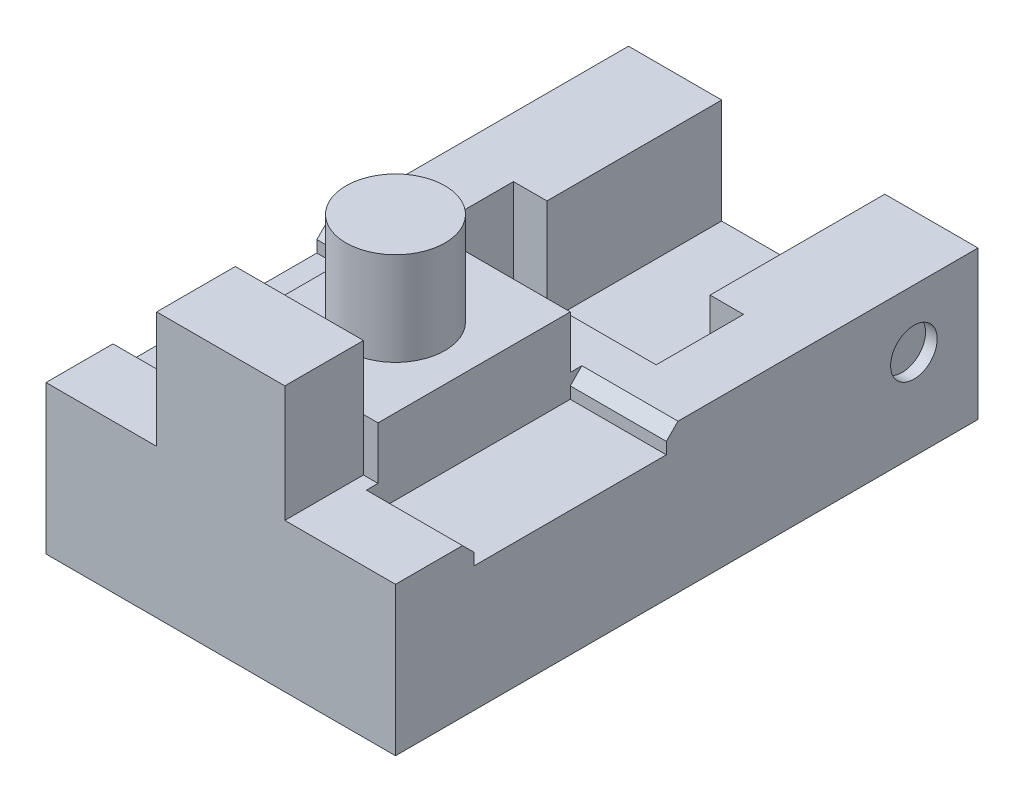
from build123d import *

# Parameters (mm, degrees)
BOSS_EXTRUDE1_DEPTH = 1.8
SKETCH2_W           = 6
SKETCH2_H           = 10
BOSS_EXTRUDE2_DEPTH = 0.75
SKETCH3_W           = 2.7
SKETCH3_H           = 3.3
BOSS_EXTRUDE3_DEPTH = 0.9
SKETCH4_R           = 0.85
BOSS_EXTRUDE4_DEPTH = 1.6
SKETCH5_W           = 2.2
SKETCH5_H           = 1.35
BOSS_EXTRUDE5_DEPTH = 2
SKETCH7_W           = 1.65
SKETCH7_H           = 3.3
CUT_EXTRUDE2_DEPTH  = 0.4
CHAMFER1_SIZE       = 0.2
SKETCH9_R           = 0.4
CUT_EXTRUDE4_DEPTH  = 0.2


with BuildPart() as part:
    # Sketch1 → Boss-Extrude1 (new body)
    with BuildSketch(Plane(origin=(0, 0, 0), x_dir=(1, 0, 0), z_dir=(0, 1, 0))):
        Polygon((-1.4, 3), (-1.4, 0), (-1.975, 0), (-1.975, -1.5), (1.975, -1.5), (1.975, 0), (1.4, 0), (1.4, 3), (3, 3), (3, -7), (-3, -7), (-3, 3), align=None)
    extrude(amount=BOSS_EXTRUDE1_DEPTH)

    # Sketch2 → Boss-Extrude2 (add)
    with BuildSketch(Plane.XZ):
        with Locations((0, 2)):
            Rectangle(SKETCH2_W, SKETCH2_H)
    extrude(amount=BOSS_EXTRUDE2_DEPTH)

    # Sketch3 → Boss-Extrude3 (add)
    with BuildSketch(Plane(origin=(0, 1.8, 0), x_dir=(1, 0, 0), z_dir=(0, 1, 0))):
        with Locations((0, -4)):
            Rectangle(SKETCH3_W, SKETCH3_H)
    extrude(amount=BOSS_EXTRUDE3_DEPTH)

    # Sketch4 → Boss-Extrude4 (add)
    with BuildSketch(Plane(origin=(0, 2.7, 0), x_dir=(1, 0, 0), z_dir=(0, 1, 0))):
        with Locations(Location((0, -4, 0), (0, 0, 270))):
            Circle(SKETCH4_R)
    extrude(amount=BOSS_EXTRUDE4_DEPTH)

    # Sketch5 → Boss-Extrude5 (add)
    with BuildSketch(Plane(origin=(0, 1.8, 0), x_dir=(1, 0, 0), z_dir=(0, 1, 0))):
        with Locations((0, -6.325)):
            Rectangle(SKETCH5_W, SKETCH5_H)
    extrude(amount=BOSS_EXTRUDE5_DEPTH)

    # Sketch7 → Cut-Extrude2 (cut)
    with BuildSketch(Plane(origin=(0, 1.8, 0), x_dir=(1, 0, 0), z_dir=(0, 1, 0))):
        with Locations((-2.175, -4)):
            Rectangle(SKETCH7_W, SKETCH7_H)
        with Locations((2.175, -4)):
            Rectangle(SKETCH7_W, SKETCH7_H)
    extrude(amount=-CUT_EXTRUDE2_DEPTH, mode=Mode.SUBTRACT)

    # Chamfer1
    chamfer1_edges = [part.edges().sort_by_distance(p)[0] for p in [
        (-2.175, 1.8, 2.35),
        (-2.175, 1.8, 5.65),
        (2.175, 1.8, 5.65),
        (2.175, 1.8, 2.35),
    ]]
    chamfer(chamfer1_edges, length=CHAMFER1_SIZE)

    # Sketch9 → Cut-Extrude4 (cut)
    with BuildSketch(Plane(origin=(3, 0, 0), x_dir=(0, 0, -1), z_dir=(1, 0, 0))):
        with Locations((1.9, 0.8)):
            Circle(SKETCH9_R)
    cut_extrude4 = extrude(amount=-CUT_EXTRUDE4_DEPTH, mode=Mode.SUBTRACT)

    # Mirror1: Cut-Extrude4 across plane
    add(cut_extrude4.mirror(Plane(origin=(0, 0, 0), x_dir=(0, 0, 1), z_dir=(1, 0, 0))), mode=Mode.SUBTRACT)


solid = part.part
